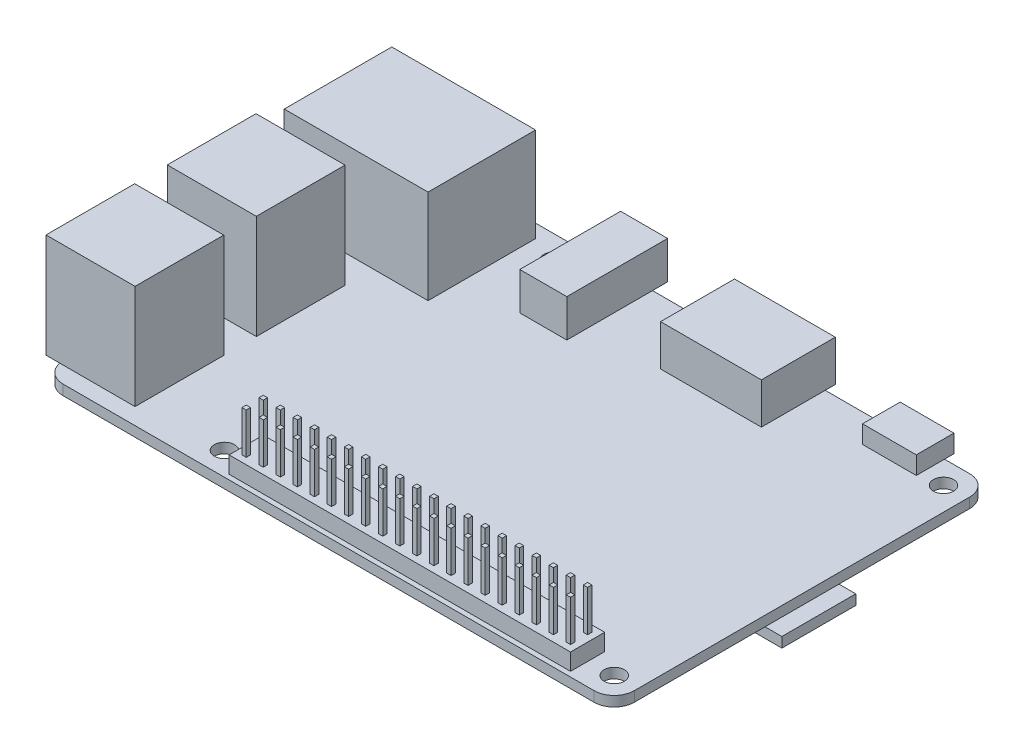
from build123d import *

# Parameters (mm, degrees)
SKETCH1_R            = 1.5
BOSS_EXTRUDE1_DEPTH  = 1.5
SKETCH2_W            = 15.5
SKETCH2_H            = 11
BOSS_EXTRUDE2_DEPTH  = 1.5
SKETCH3_W            = 21.4
SKETCH3_H            = 16
BOSS_EXTRUDE3_DEPTH  = 14
SKETCH4_W            = 13.25
SKETCH4_H            = 13.2
BOSS_EXTRUDE4_DEPTH  = 15.5
SKETCH5_W            = 15
SKETCH5_H            = 11
BOSS_EXTRUDE5_DEPTH  = 6.1
SKETCH6_W            = 7
SKETCH6_H            = 15
BOSS_EXTRUDE6_DEPTH  = 5.6
SKETCH7_W            = 8
SKETCH7_H            = 5.6
BOSS_EXTRUDE7_DEPTH  = 2.66
SKETCH8_W            = 2.54
SKETCH8_H            = 2.54
BOSS_EXTRUDE8_DEPTH  = 2.5
SKETCH8_3_W          = 0.64
SKETCH8_3_H          = 0.64
BOSS_EXTRUDE9_DEPTH  = 8.6
LPATTERN1_COUNT      = 20
LPATTERN1_PITCH      = 2.54
LPATTERN1_COUNT_DIR2 = 2
LPATTERN1_PITCH_DIR2 = 2.54


with BuildPart() as part:
    # Sketch1 → Boss-Extrude1 (new body)
    with BuildSketch(Plane(origin=(0, 0, 0), x_dir=(1, 0, 0), z_dir=(0, 1, 0))):
        with BuildLine():
            Line((-39.5, -27.95), (39.5, -27.95))
            ThreePointArc((39.5, -27.95), (41.621320344, -27.071320344), (42.5, -24.95))
            Line((42.5, -24.95), (42.5, 24.95))
            ThreePointArc((42.5, 24.95), (41.621320344, 27.071320344), (39.5, 27.95))
            Line((39.5, 27.95), (-39.5, 27.95))
            ThreePointArc((-39.5, 27.95), (-41.621320344, 27.071320344), (-42.5, 24.95))
            Line((-42.5, 24.95), (-42.5, -24.95))
            ThreePointArc((-42.5, -24.95), (-41.621320344, -27.071320344), (-39.5, -27.95))
        make_face()
        with Locations((-18.95, 24.5)):
            Circle(SKETCH1_R, mode=Mode.SUBTRACT)
        with Locations((39.05, 24.5)):
            Circle(SKETCH1_R, mode=Mode.SUBTRACT)
        with Locations((39.05, -24.5)):
            Circle(SKETCH1_R, mode=Mode.SUBTRACT)
        with Locations((-18.95, -24.5)):
            Circle(SKETCH1_R, mode=Mode.SUBTRACT)
    extrude(amount=BOSS_EXTRUDE1_DEPTH)

    # Sketch2 → Boss-Extrude2 (add)
    with BuildSketch(Plane.XZ):
        with Locations((37.25, 0)):
            Rectangle(SKETCH2_W, SKETCH2_H)
    extrude(amount=BOSS_EXTRUDE2_DEPTH)

    # Sketch3 → Boss-Extrude3 (add)
    with BuildSketch(Plane(origin=(0, 1.5, 0), x_dir=(1, 0, 0), z_dir=(0, 1, 0))):
        with Locations((-33.8, 17.95)):
            Rectangle(SKETCH3_W, SKETCH3_H)
    extrude(amount=BOSS_EXTRUDE3_DEPTH)

    # Sketch4 → Boss-Extrude4 (add)
    with BuildSketch(Plane(origin=(0, 1.5, 0), x_dir=(1, 0, 0), z_dir=(0, 1, 0))):
        with Locations((-37.875, -0.85)):
            Rectangle(SKETCH4_W, SKETCH4_H)
        with Locations((-37.875, -18.9)):
            Rectangle(SKETCH4_W, SKETCH4_H)
    extrude(amount=BOSS_EXTRUDE4_DEPTH)

    # Sketch5 → Boss-Extrude5 (add)
    with BuildSketch(Plane(origin=(0, 1.5, 0), x_dir=(1, 0, 0), z_dir=(0, 1, 0))):
        with Locations((10.5, 23.95)):
            Rectangle(SKETCH5_W, SKETCH5_H)
    extrude(amount=BOSS_EXTRUDE5_DEPTH)

    # Sketch6 → Boss-Extrude6 (add)
    with BuildSketch(Plane(origin=(0, 1.5, 0), x_dir=(1, 0, 0), z_dir=(0, 1, 0))):
        with Locations((-11.2, 22.7)):
            Rectangle(SKETCH6_W, SKETCH6_H)
    extrude(amount=BOSS_EXTRUDE6_DEPTH)

    # Sketch7 → Boss-Extrude7 (add)
    with BuildSketch(Plane(origin=(0, 1.5, 0), x_dir=(1, 0, 0), z_dir=(0, 1, 0))):
        with Locations((31.75, 26.55)):
            Rectangle(SKETCH7_W, SKETCH7_H)
    extrude(amount=BOSS_EXTRUDE7_DEPTH)

    # Sketch8 → Boss-Extrude8 (add)
    with BuildSketch(Plane(origin=(0, 1.5, 0), x_dir=(1, 0, 0), z_dir=(0, 1, 0))):
        with Locations((34, -25.95)):
            Rectangle(SKETCH8_W, SKETCH8_H)
    boss_extrude8 = extrude(amount=BOSS_EXTRUDE8_DEPTH)

    # Sketch8<3> → Boss-Extrude9 (add)
    with BuildSketch(Plane(origin=(0, 1.5, 0), x_dir=(1, 0, 0), z_dir=(0, 1, 0))):
        with Locations((34, -25.95)):
            Rectangle(SKETCH8_3_W, SKETCH8_3_H)
    boss_extrude9 = extrude(amount=BOSS_EXTRUDE9_DEPTH)

    # LPattern1: Boss-Extrude8, Boss-Extrude9 20 × 2
    with Locations(*[(-i * LPATTERN1_PITCH, 0, -j * LPATTERN1_PITCH_DIR2) for i in range(LPATTERN1_COUNT) for j in range(LPATTERN1_COUNT_DIR2) if (i, j) != (0, 0)]):
        add(boss_extrude8)
        add(boss_extrude9)


solid = part.part
